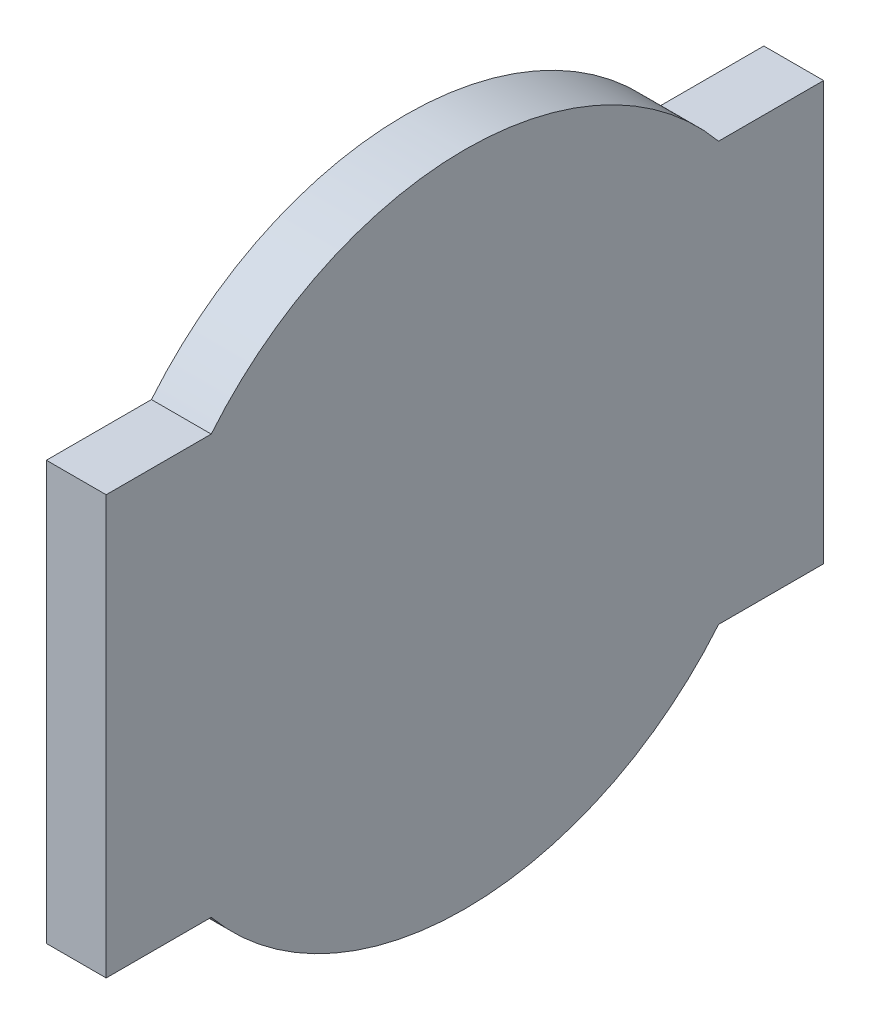
from build123d import *

# Parameters (mm, degrees)
BOSS_EXTRUDE1_DEPTH = 6.35


with BuildPart() as part:
    # Sketch1 → Boss-Extrude1 (new body)
    with BuildSketch(Plane(origin=(0, 0, 0), x_dir=(0, 0, -1), z_dir=(1, 0, 0))):
        with BuildLine():
            ThreePointArc((-26.940768363, 22.225), (-34.925, 0), (-26.940768363, -22.225))
            Line((-26.940768363, -22.225), (26.940768363, -22.225))
            ThreePointArc((26.940768363, -22.225), (32.868388766, -11.807821347), (34.925, 0))
            ThreePointArc((34.925, 0), (32.868388766, 11.807821347), (26.940768363, 22.225))
            Line((26.940768363, 22.225), (-26.940768363, 22.225))
        make_face()
        with BuildLine():
            Line((-38.1, 22.225), (-38.1, -22.225))
            Line((-38.1, -22.225), (-26.940768363, -22.225))
            ThreePointArc((-26.940768363, -22.225), (-34.925, 0), (-26.940768363, 22.225))
            Line((-26.940768363, 22.225), (-38.1, 22.225))
        make_face()
        with BuildLine():
            ThreePointArc((26.940768363, 22.225), (0, 34.925), (-26.940768363, 22.225))
            Line((-26.940768363, 22.225), (26.940768363, 22.225))
        make_face()
        with BuildLine():
            ThreePointArc((34.925, 0), (32.868388766, -11.807821347), (26.940768363, -22.225))
            Line((26.940768363, -22.225), (38.1, -22.225))
            Line((38.1, -22.225), (38.1, 22.225))
            Line((38.1, 22.225), (26.940768363, 22.225))
            ThreePointArc((26.940768363, 22.225), (32.868388766, 11.807821347), (34.925, 0))
        make_face()
        with BuildLine():
            Line((26.940768363, -22.225), (-26.940768363, -22.225))
            ThreePointArc((-26.940768363, -22.225), (0, -34.925), (26.940768363, -22.225))
        make_face()
    extrude(amount=BOSS_EXTRUDE1_DEPTH)


solid = part.part
